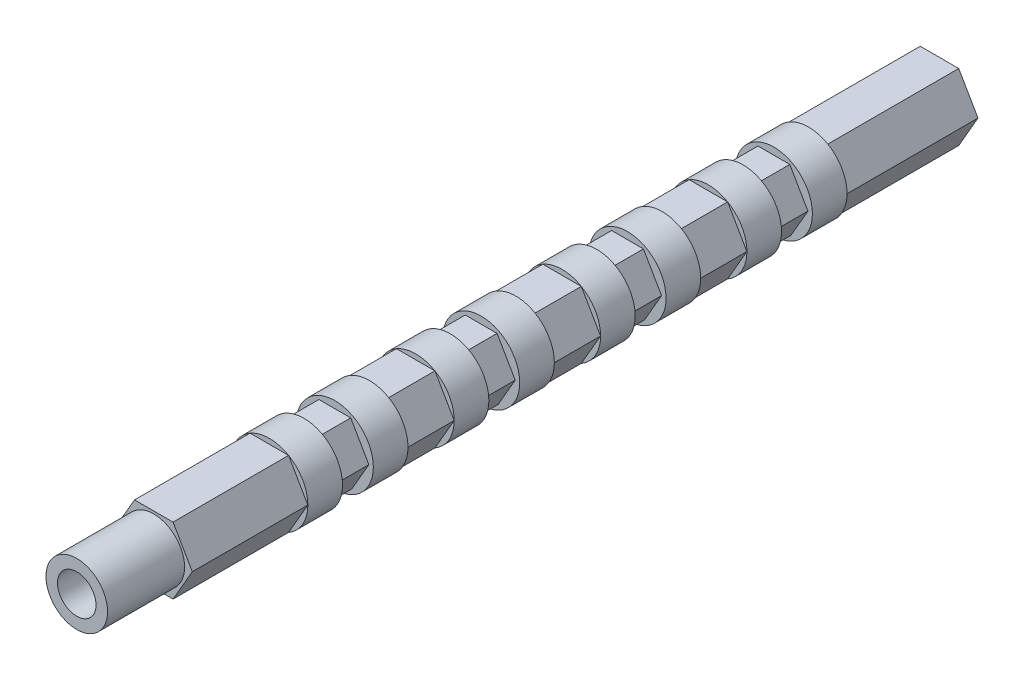
from build123d import *

# Parameters (mm, degrees)
BOSS_EXTRUDE1_DEPTH      = 51
BOSS_EXTRUDE1_DEPTH_BACK = 51
SKETCH2_R                = 4
BOSS_EXTRUDE2_DEPTH      = 10
SKETCH3_R                = 2.5
CUT_EXTRUDE1_DEPTH       = 8
SKETCH4_R                = 1.75
CUT_EXTRUDE2_DEPTH       = 30
SKETCH5_R                = 1.7
CUT_EXTRUDE3_DEPTH       = 30
SKETCH7_R                = 5
BOSS_EXTRUDE3_DEPTH      = 6.5
CUT_EXTRUDE_THIN2_DEPTH  = 2
LPATTERN1_COUNT          = 4
LPATTERN1_PITCH          = 19


with BuildPart() as part:
    # Sketch1 → Boss-Extrude1 (new, two sides: drawn at the far end of the back side and taken through both)
    with BuildSketch(Plane.XY.offset(-BOSS_EXTRUDE1_DEPTH_BACK)):
        Polygon((2.5, -4.330127019), (5, 0), (2.5, 4.330127019), (-2.5, 4.330127019), (-5, 0), (-2.5, -4.330127019), align=None)
    extrude(amount=BOSS_EXTRUDE1_DEPTH + BOSS_EXTRUDE1_DEPTH_BACK)

    # Sketch2 → Boss-Extrude2 (add)
    with BuildSketch(Plane.XY.offset(51)):
        Circle(SKETCH2_R)
    extrude(amount=BOSS_EXTRUDE2_DEPTH)

    # Sketch3 → Cut-Extrude1 (cut)
    with BuildSketch(Plane.XY.offset(61)):
        Circle(SKETCH3_R)
    extrude(amount=-CUT_EXTRUDE1_DEPTH, mode=Mode.SUBTRACT)

    # Sketch4 → Cut-Extrude2 (cut)
    with BuildSketch(Plane.XY.offset(53)):
        Circle(SKETCH4_R)
    extrude(amount=-CUT_EXTRUDE2_DEPTH, mode=Mode.SUBTRACT)

    # Sketch5 → Cut-Extrude3 (cut)
    with BuildSketch(Plane(origin=(0, 0, -51), x_dir=(-1, 0, 0), z_dir=(0, 0, -1))):
        Circle(SKETCH5_R)
    extrude(amount=-CUT_EXTRUDE3_DEPTH, mode=Mode.SUBTRACT)

    # Sketch7 → Boss-Extrude3 (add, symmetric)
    with BuildSketch(Plane.XY.offset(29.5)):
        Circle(SKETCH7_R)
    boss_extrude3 = extrude(amount=BOSS_EXTRUDE3_DEPTH, both=True)

    # Sketch8 → Cut-Extrude-Thin2 (cut, symmetric)
    with BuildSketch(Plane.XY.offset(29.5)):
        Polygon((3.366025404, -5.830127019), (-3.366025404, -5.830127019), (-6.732050808, 0), (-3.221687836, 6.080127019), (3.221687836, 6.080127019), (6.732050808, 0), align=None)
        Polygon((2.211324865, -3.830127019), (-2.211324865, -3.830127019), (-4.422649731, 0), (-2.066987298, 4.080127019), (2.066987298, 4.080127019), (4.422649731, 0), align=None, mode=Mode.SUBTRACT)
    cut_extrude_thin2 = extrude(amount=CUT_EXTRUDE_THIN2_DEPTH, both=True, mode=Mode.SUBTRACT)

    # LPattern1: Boss-Extrude3, Cut-Extrude-Thin2 ×4
    with Locations(*[(0, 0, -i * LPATTERN1_PITCH) for i in range(1, LPATTERN1_COUNT)]):
        add(boss_extrude3)
        add(cut_extrude_thin2, mode=Mode.SUBTRACT)


solid = part.part
